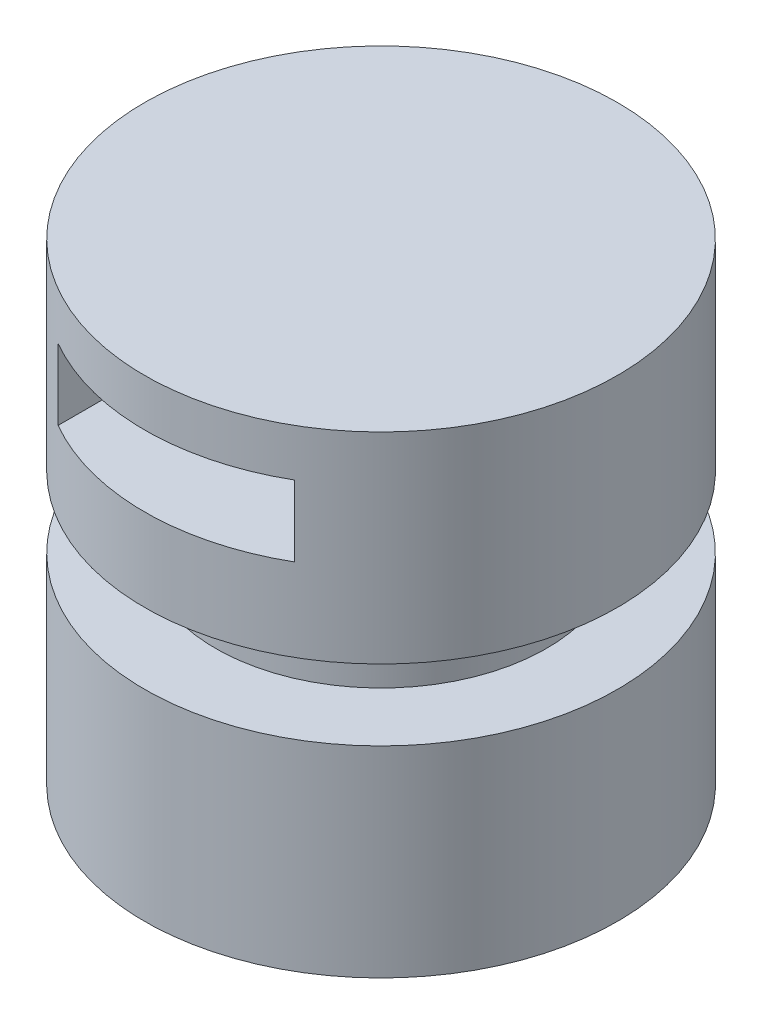
from build123d import *

# Parameters (mm, degrees)
SKETCH1_W               = 100
SKETCH1_H               = 200
SKETCH2_W               = 30
SKETCH2_H               = 30
CUT_EXTRUDE1_DEPTH      = 245.948974278
CUT_EXTRUDE1_DEPTH_BACK = 245.948974278
SKETCH3_W               = 100
SKETCH3_H               = 30


with BuildPart() as part:
    # Sketch1 → Revolve1 (revolve)
    with BuildSketch(Plane.XY, mode=Mode.PRIVATE) as revolve1_sk:
        with Locations((50, 100)):
            Rectangle(SKETCH1_W, SKETCH1_H)
    revolve(revolve1_sk.sketch.rotate(Axis((0, 0, 0), (0, 1, 0)), 90), axis=Axis((0, 0, 0), (0, 1, 0)))

    # Sketch2 → Cut-Revolve1 (revolve, cut)
    with BuildSketch(Plane(origin=(0, 0, 0), x_dir=(0, 0, -1), z_dir=(1, 0, 0))):
        with Locations((85, 100)):
            Rectangle(SKETCH2_W, SKETCH2_H)
    revolve(axis=Axis((0, -52.421794963, 0), (0, 1, 0)), mode=Mode.SUBTRACT)

    # Sketch3 → Cut-Extrude1 (cut, two sides: drawn at the far end of the back side and taken through both)
    with BuildSketch(Plane.XY.offset(-CUT_EXTRUDE1_DEPTH_BACK)):
        with Locations((0, 165)):
            Rectangle(SKETCH3_W, SKETCH3_H)
    extrude(amount=CUT_EXTRUDE1_DEPTH + CUT_EXTRUDE1_DEPTH_BACK, mode=Mode.SUBTRACT)


solid = part.part
